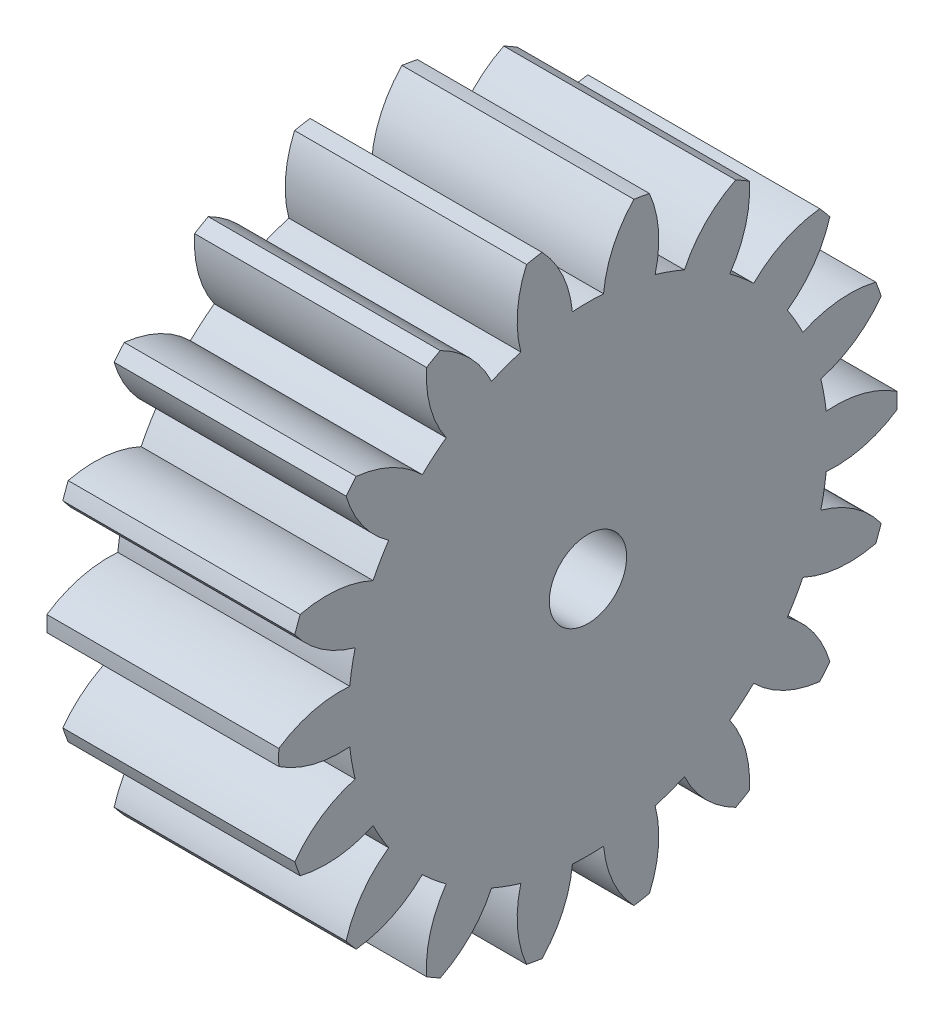
from build123d import *

# Parameters (mm, degrees)
BASPROSKE_W     = 15
BASPROSKE_H     = 20
TOOTHCUT_DEPTH  = 33.015621187
TEETHCUTS_COUNT = 18
TEETHCUTS_ANGLE = 340
BORSKE_R        = 2.5
BORE_DEPTH      = 50.0000508


with BuildPart() as part:
    # BasProSke → Base-Revolve (revolve)
    with BuildSketch(Plane(origin=(0, 0, 0), x_dir=(1, 0, 0), z_dir=(0, 1, 0)), mode=Mode.PRIVATE) as base_revolve_sk:
        with Locations((7.5, 10)):
            Rectangle(BASPROSKE_W, BASPROSKE_H)
    revolve(base_revolve_sk.sketch.rotate(Axis((-10, 0, 0), (1, 0, 0)), 180), axis=Axis((-10, 0, 0), (1, 0, 0)))

    # TooCutSke → ToothCut (cut, through all)
    with BuildSketch(Plane(origin=(0, 0, 0), x_dir=(0, 0, -1), z_dir=(1, 0, 0))):
        with BuildLine():
            ThreePointArc((1.007799284, 15.466199973), (0, 15.499), (-1.007799284, 15.466199973))
            ThreePointArc((-1.007799284, 15.466199973), (-1.630454606, 17.802374148), (-2.991345877, 19.800719558))
            ThreePointArc((-2.991345877, 19.800719558), (0, 20.0254), (2.991345877, 19.800719558))
            ThreePointArc((2.991345877, 19.800719558), (1.630454606, 17.802374148), (1.007799284, 15.466199973))
        make_face()
    toothcut = extrude(amount=TOOTHCUT_DEPTH, mode=Mode.SUBTRACT)

    # TeethCuts: ToothCut ×18 about axis
    teethcuts_axis = Axis((-10, 0, 0), (1, 0, 0))
    for i in range(1, TEETHCUTS_COUNT):
        add(toothcut.rotate(teethcuts_axis, i * TEETHCUTS_ANGLE / (TEETHCUTS_COUNT - 1)), mode=Mode.SUBTRACT)

    # BorSke → Bore (cut, symmetric)
    with BuildSketch(Plane(origin=(0, 0, 0), x_dir=(0, 0, -1), z_dir=(1, 0, 0))):
        with Locations(Location((0, 0, 0), (0, 0, 180))):
            Circle(BORSKE_R)
    extrude(amount=BORE_DEPTH, both=True, mode=Mode.SUBTRACT)


solid = part.part
